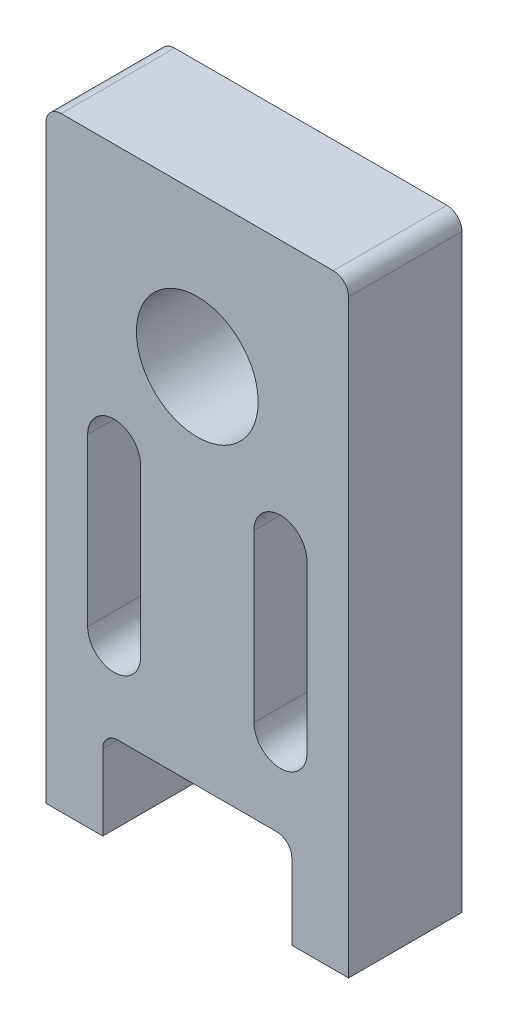
from build123d import *

# Parameters (mm, degrees)
SKETCH_1_W          = 40
SKETCH_1_H          = 80
EXTRUDE_1_DEPTH     = 15
SKETCH_2_R          = 8.05
CUT_EXTRUDE_1_DEPTH = 60
SKETCH_3_W          = 25
SKETCH_3_H          = 16.969379431
CUT_EXTRUDE_2_DEPTH = 60
SKETCH_4_R          = 1.45
CUT_EXTRUDE_3_DEPTH = 35
CUT_EXTRUDE_4_DEPTH = 35
FILLET_1_R          = 2


with BuildPart() as part:
    # 草图1 → 凸台-拉伸1 (new body)
    with BuildSketch(Plane.XY):
        Rectangle(SKETCH_1_W, SKETCH_1_H)
    extrude(amount=EXTRUDE_1_DEPTH)

    # 草图2 → 切除-拉伸1 (cut)
    with BuildSketch(Plane.XY.offset(15)):
        with Locations((0, 20)):
            Circle(SKETCH_2_R)
    extrude(amount=-CUT_EXTRUDE_1_DEPTH, mode=Mode.SUBTRACT)

    # 草图3 → 切除-拉伸2 (cut)
    with BuildSketch(Plane.XY.offset(15)):
        with Locations((0, -36.484689715)):
            Rectangle(SKETCH_3_W, SKETCH_3_H)
    extrude(amount=-CUT_EXTRUDE_2_DEPTH, mode=Mode.SUBTRACT)

    # 草图4 → 切除-拉伸3 (cut)
    with BuildSketch(Plane.XZ.offset(28)):
        with Locations(Location((0, 7.5, 0), (0, 0, 270))):
            Circle(SKETCH_4_R)
    extrude(amount=-CUT_EXTRUDE_3_DEPTH, mode=Mode.SUBTRACT)

    # 草图5 → 切除-拉伸4 (cut)
    with BuildSketch(Plane.XY.offset(15)):
        with BuildLine():
            Line((-7.5, 5), (-7.5, -17))
            ThreePointArc((-7.5, -17), (-11, -20.5), (-14.5, -17))
            Line((-14.5, -17), (-14.5, 5))
            ThreePointArc((-14.5, 5), (-11, 8.5), (-7.5, 5))
        make_face()
        with BuildLine():
            Line((14.5, 5), (14.5, -17))
            ThreePointArc((14.5, -17), (11, -20.5), (7.5, -17))
            Line((7.5, -17), (7.5, 5))
            ThreePointArc((7.5, 5), (11, 8.5), (14.5, 5))
        make_face()
    extrude(amount=-CUT_EXTRUDE_4_DEPTH, mode=Mode.SUBTRACT)

    # 圆角1
    fillet_1_edges = [part.edges().sort_by_distance(p)[0] for p in [
        (12.5, -28, 7.5),
        (-12.5, -28, 7.5),
        (-20, 40, 7.5),
        (20, 40, 7.5),
    ]]
    fillet(fillet_1_edges, radius=FILLET_1_R)


solid = part.part
